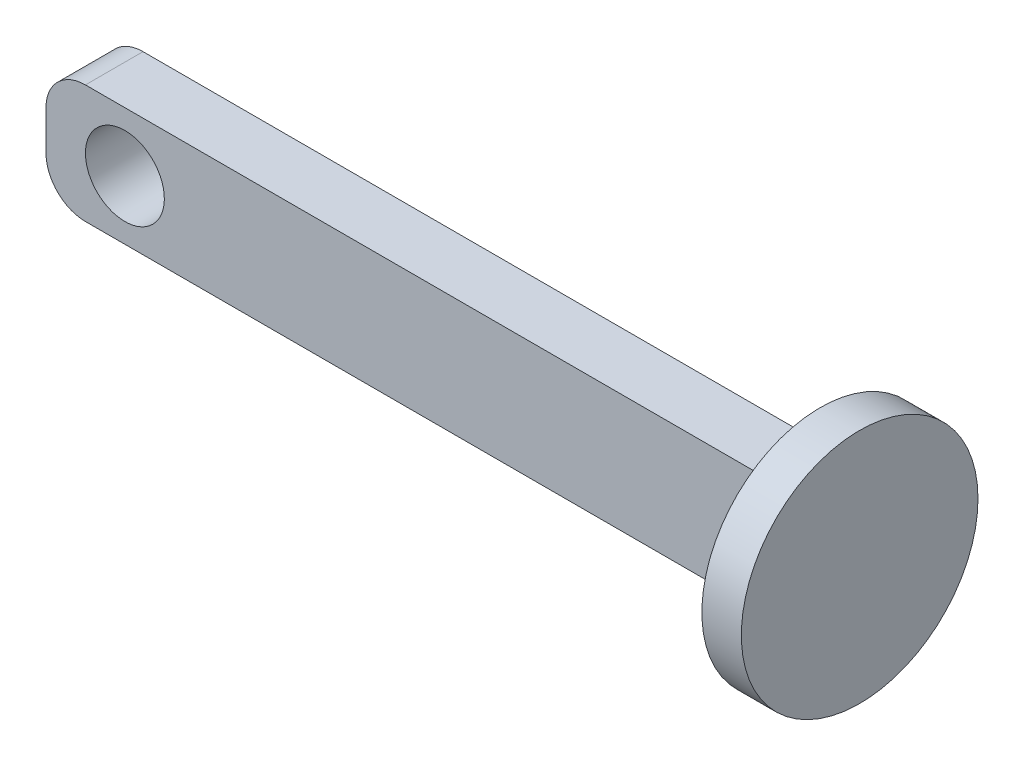
from build123d import *

# Parameters (mm, degrees)
SKETCH1_R           = 9.525
BOSS_EXTRUDE1_DEPTH = 3.175
SKETCH2_W           = 4.6355
SKETCH2_H           = 9.525
BOSS_EXTRUDE2_DEPTH = 60
FILLET1_R           = 3.175
SKETCH3_R           = 3.175
CUT_EXTRUDE1_DEPTH  = 62.894881473


with BuildPart() as part:
    # Sketch1 → Boss-Extrude1 (new body)
    with BuildSketch(Plane(origin=(0, 0, 0), x_dir=(0, 0, -1), z_dir=(1, 0, 0))):
        Circle(SKETCH1_R)
    extrude(amount=BOSS_EXTRUDE1_DEPTH)

    # Sketch2 → Boss-Extrude2 (add)
    with BuildSketch(Plane.ZY):
        Rectangle(SKETCH2_W, SKETCH2_H)
    extrude(amount=BOSS_EXTRUDE2_DEPTH)

    # Fillet1
    fillet1_edges = [part.edges().sort_by_distance(p)[0] for p in [
        (-60, 4.7625, 0),
        (-60, -4.7625, 0),
    ]]
    fillet(fillet1_edges, radius=FILLET1_R)

    # Sketch3 → Cut-Extrude1 (cut, through all)
    with BuildSketch(Plane(origin=(0, 0, -2.31775), x_dir=(-1, 0, 0), z_dir=(0, 0, -1))):
        with Locations(Location((53.65, 0, 0), (0, 0, 90))):
            Circle(SKETCH3_R)
    extrude(amount=-CUT_EXTRUDE1_DEPTH, mode=Mode.SUBTRACT)


solid = part.part
